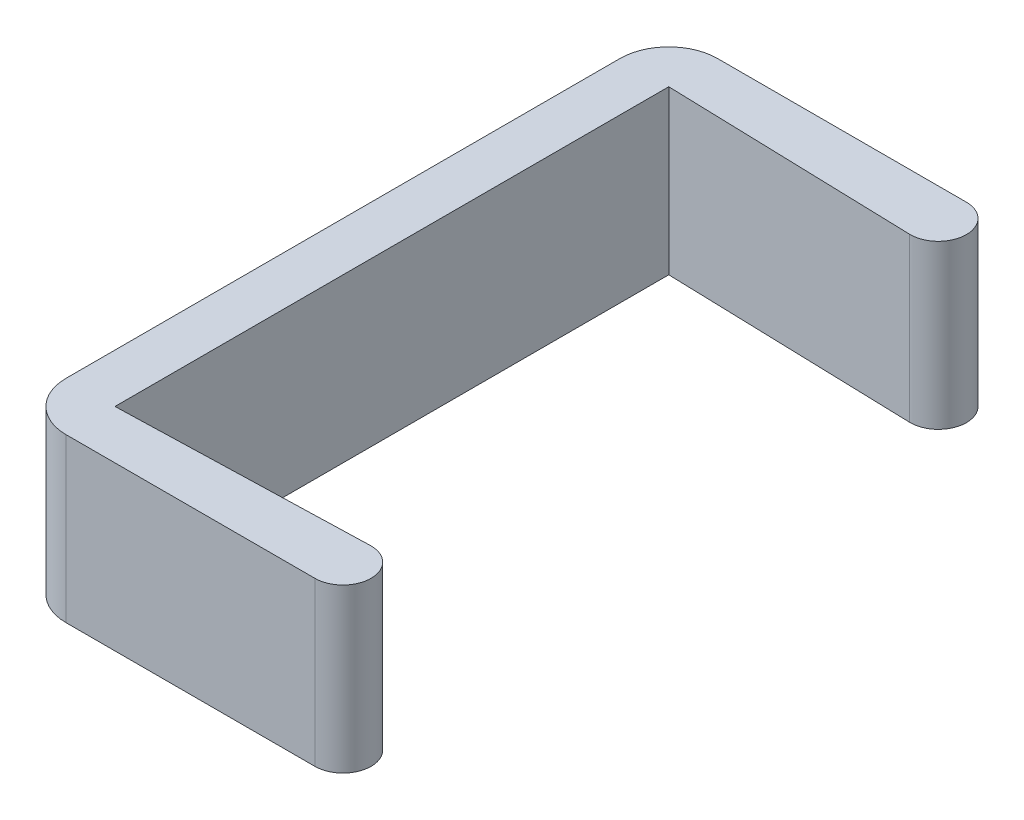
from build123d import *

# Parameters (mm, degrees)
BOSS_EXTRUDE1_DEPTH = 10
FILLET1_R           = 3
FILLET2_R           = 1.72427
FILLET3_R           = 1.72427


with BuildPart() as part:
    # Sketch1 → Boss-Extrude1 (new body)
    with BuildSketch(Plane(origin=(0, 0, 0), x_dir=(1, 0, 0), z_dir=(0, 1, 0))):
        Polygon((0, -16.5), (0, -20), (-20, -20), (-20, 20), (0, 20), (0, 16.5), (-17, 17), (-17, -17), align=None)
    extrude(amount=BOSS_EXTRUDE1_DEPTH)

    # Fillet1
    fillet1_edges = [part.edges().sort_by_distance(p)[0] for p in [
        (-20, 5, -20),
        (-20, 5, 20),
    ]]
    fillet(fillet1_edges, radius=FILLET1_R)

    # Fillet2
    fillet2_edges = [part.edges().sort_by_distance(p)[0] for p in [
        (0, 5, 16.5),
        (0, 5, 20),
    ]]
    fillet(fillet2_edges, radius=FILLET2_R)

    # Fillet3
    fillet3_edges = [part.edges().sort_by_distance(p)[0] for p in [
        (0, 5, -20),
        (0, 5, -16.5),
    ]]
    fillet(fillet3_edges, radius=FILLET3_R)


solid = part.part
